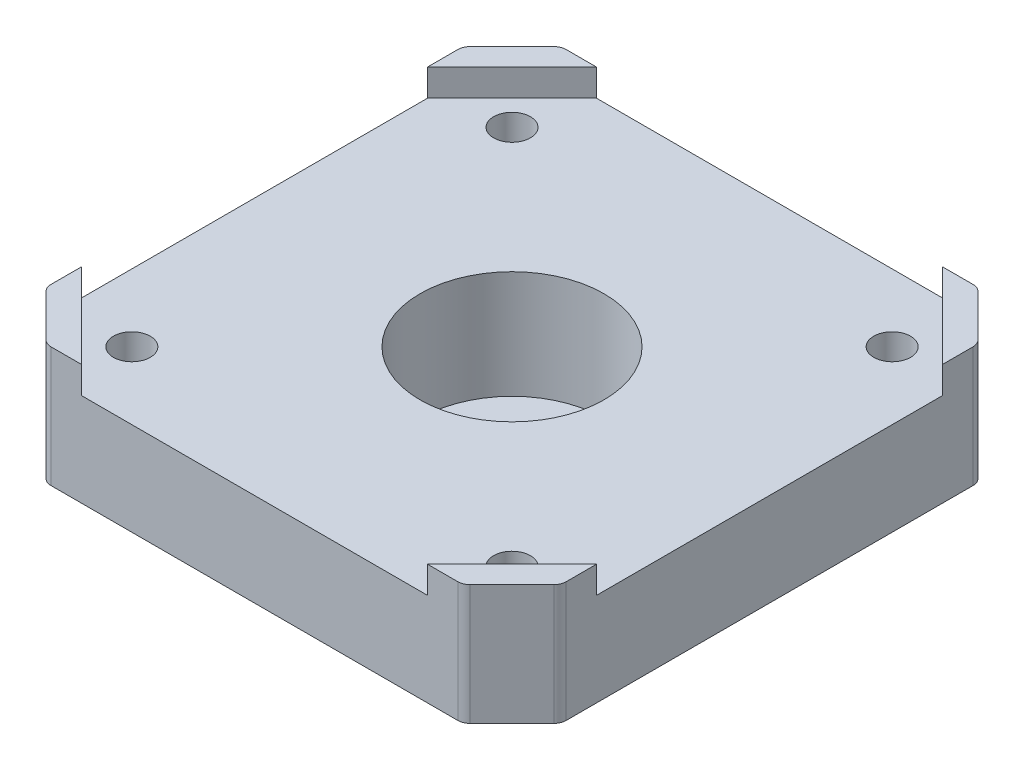
from build123d import *

# Parameters (mm, degrees)
SALIENTE_EXTRUIR1_DEPTH                              = 9.8
CORTAR_EXTRUIR1_DEPTH                                = 2.2
SALIENTE_EXTRUIR2_DEPTH                              = 2.2
SALIENTE_EXTRUIR3_DEPTH                              = 2.2
TALADRO_DE_MARGEN_PARA_M241_D                        = 27.8721
TALADRO_DE_MARGEN_PARA_M241_DEPTH                    = 0.3
CROQUIS7_W                                           = 10.5
CROQUIS7_H                                           = 2.86
REFRENTADO_PARA_PERNO_CON_CABEZA_HEXAGON_D           = 8.45
REFRENTADO_PARA_PERNO_CON_CABEZA_HEXAGON_CBORE_D     = 15
REFRENTADO_PARA_PERNO_CON_CABEZA_HEXAGON_CBORE_DEPTH = 8.8
DI_METRO_DE_TALADRO_3_0_3_1_D                        = 3
DI_METRO_DE_TALADRO_3_0_3_1_DEPTH                    = 10.16
CHAFL_N1_SIZE                                        = 0.25
REDONDEO1_R                                          = 1


with BuildPart() as part:
    # Croquis1 → Saliente-Extruir1 (new body)
    with BuildSketch(Plane(origin=(0, 0, 0), x_dir=(1, 0, 0), z_dir=(0, 1, 0))):
        Polygon((-21, 17), (-21, -17), (-17, -21), (17, -21), (21, -17), (21, 17), (17, 21), (-17, 21), align=None)
    extrude(amount=-SALIENTE_EXTRUIR1_DEPTH)

    # Croquis2 → Cortar-Extruir1 (cut)
    with BuildSketch(Plane(origin=(0, 0, 0), x_dir=(-1, 0, 0), z_dir=(0, 1, 0))):
        Polygon((-14.100780618, -21), (14.100780618, -21), (21, -14.100780618), (21, 17), (17, 21), (-17, 21), (-21, 17), (-21, -14.100780618), align=None)
    extrude(amount=-CORTAR_EXTRUIR1_DEPTH, mode=Mode.SUBTRACT)

    # Croquis3 → Saliente-Extruir2 (add)
    with BuildSketch(Plane(origin=(0, -2.2, 0), x_dir=(-1, 0, 0), z_dir=(0, 1, 0))):
        Polygon((-14.100780618, 21), (-21, 14.100780618), (-21, 17), (-17, 21), align=None)
    extrude(amount=SALIENTE_EXTRUIR2_DEPTH)

    # Croquis4 → Saliente-Extruir3 (add)
    with BuildSketch(Plane(origin=(0, -2.2, 0), x_dir=(-1, 0, 0), z_dir=(0, 1, 0))):
        Polygon((17, 21), (21, 17), (21, 14.100780618), (14.100780618, 21), align=None)
    extrude(amount=SALIENTE_EXTRUIR3_DEPTH)

    # Taladro de margen para M241
    with Locations(Plane(origin=(0, -9.8, 0), x_dir=(-1, 0, 0), z_dir=(0, -1, 0))):
        with Locations((0, 0)):
            Hole(TALADRO_DE_MARGEN_PARA_M241_D / 2, depth=TALADRO_DE_MARGEN_PARA_M241_DEPTH)

    # Croquis7 → Revolución1 (revolve)
    with BuildSketch(Plane.XY, mode=Mode.PRIVATE) as revoluci_n1_sk:
        with Locations((5.25, -10.93)):
            Rectangle(CROQUIS7_W, CROQUIS7_H)
    revolve(revoluci_n1_sk.sketch.rotate(Axis((0, -9.5, 0), (0, -1, 0)), 270), axis=Axis((0, -9.5, 0), (0, -1, 0)))

    # Refrentado para perno con cabeza hexagonal de M81 (through all)
    with Locations(Plane(origin=(0, -2.2, 0), x_dir=(1, 0, 0), z_dir=(0, 1, 0))):
        with Locations((0, 0)):
            CounterBoreHole(REFRENTADO_PARA_PERNO_CON_CABEZA_HEXAGON_D / 2, REFRENTADO_PARA_PERNO_CON_CABEZA_HEXAGON_CBORE_D / 2, REFRENTADO_PARA_PERNO_CON_CABEZA_HEXAGON_CBORE_DEPTH)

    # Diámetro de taladro Ø3.0 (3)1
    with Locations(Plane(origin=(0, -2.2, 0), x_dir=(1, 0, 0), z_dir=(0, 1, 0))):
        with Locations((15.5, -15.5), (15.5, 15.5), (-15.5, -15.5), (-15.5, 15.5)):
            Hole(DI_METRO_DE_TALADRO_3_0_3_1_D / 2, depth=DI_METRO_DE_TALADRO_3_0_3_1_DEPTH)

    # Chaflán1
    chafl_n1_edges = [part.edges().sort_by_distance(p)[0] for p in [
        (4.225, -12.36, 0),
    ]]
    chamfer(chafl_n1_edges, length=CHAFL_N1_SIZE)

    # Redondeo1
    redondeo1_edges = [part.edges().sort_by_distance(p)[0] for p in [
        (-17, -4.9, -21),
        (17, -4.9, -21),
        (21, -4.9, -17),
        (21, -4.9, 17),
        (17, -4.9, 21),
        (-17, -4.9, 21),
        (-21, -4.9, 17),
        (-21, -4.9, -17),
    ]]
    fillet(redondeo1_edges, radius=REDONDEO1_R)


solid = part.part
